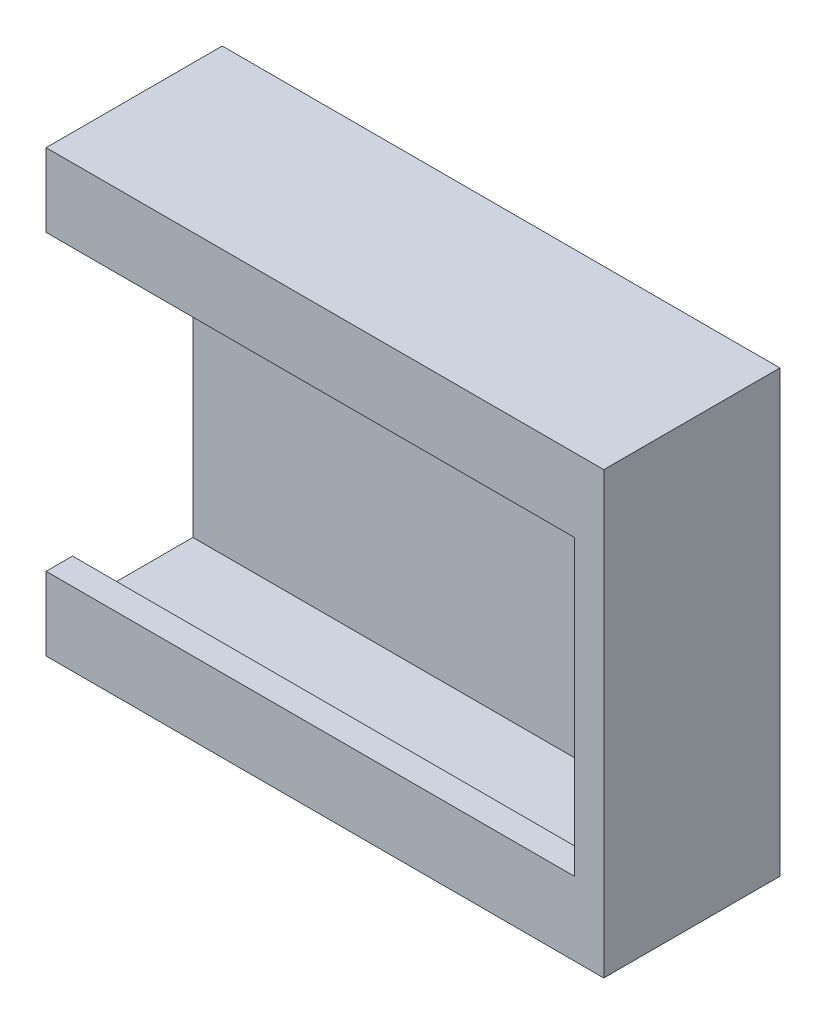
from build123d import *

# Parameters (mm, degrees)
ESQUISSE1_W        = 95
ESQUISSE1_H        = 75
BOSS_EXTRU_1_DEPTH = 5
BOSS_EXTRU_2_DEPTH = 25
ESQUISSE3_W        = 4.5
ESQUISSE3_H        = 7.5
BOSS_EXTRU_3_DEPTH = 90


with BuildPart() as part:
    # Esquisse1 → Boss.-Extru.1 (new body)
    with BuildSketch(Plane.XY):
        with Locations((47.5, 37.5)):
            Rectangle(ESQUISSE1_W, ESQUISSE1_H)
    extrude(amount=BOSS_EXTRU_1_DEPTH)

    # Esquisse2 → Boss.-Extru.2 (add)
    with BuildSketch(Plane.XY.offset(5)):
        Polygon((0, 70), (0, 75), (95, 75), (95, 0), (0, 0), (0, 5), (90, 5), (90, 70), align=None)
    extrude(amount=BOSS_EXTRU_2_DEPTH)

    # Esquisse3 → Boss.-Extru.3 (add)
    with BuildSketch(Plane.ZY.offset(-90)):
        with Locations((27.75, 66.25)):
            Rectangle(ESQUISSE3_W, ESQUISSE3_H)
        with Locations((27.75, 8.75)):
            Rectangle(ESQUISSE3_W, ESQUISSE3_H)
    extrude(amount=BOSS_EXTRU_3_DEPTH)


solid = part.part
